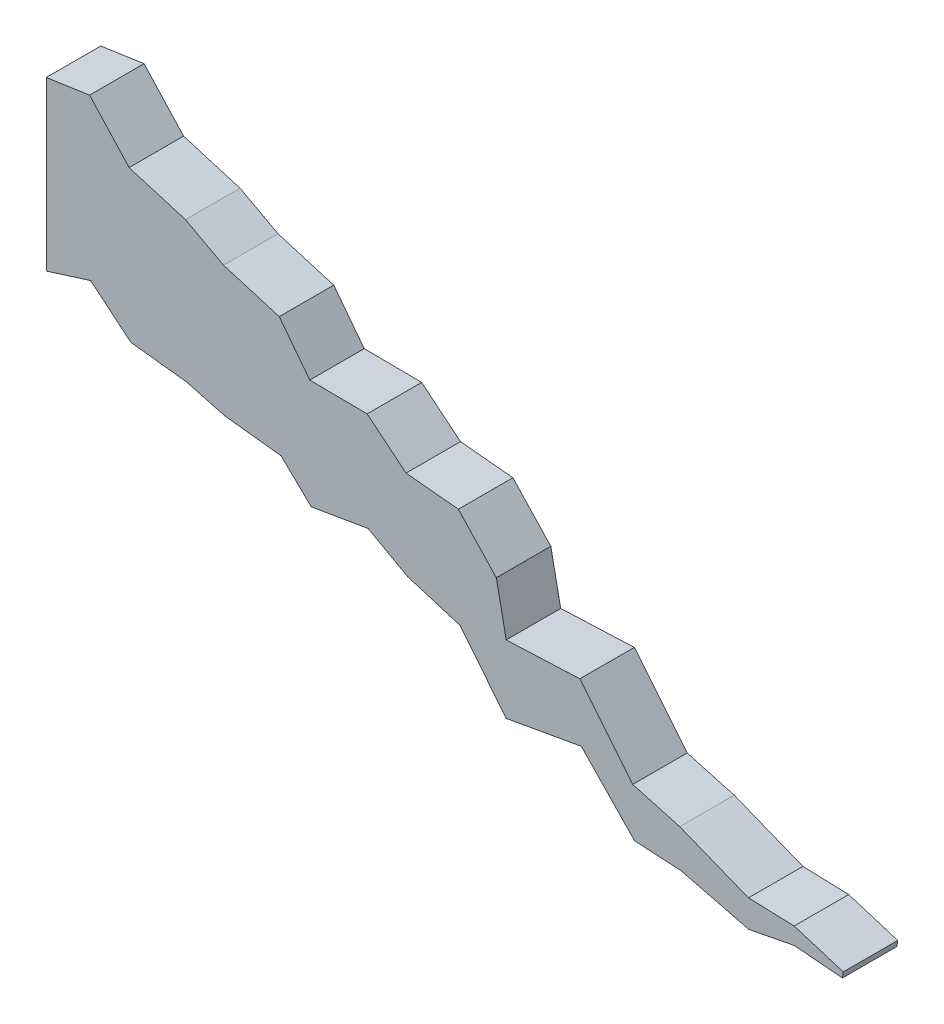
from build123d import *

# Parameters (mm, degrees)
AUFSATZ_LINEAR_AUSTRAGEN1_DEPTH = 3


with BuildPart() as part:
    # Model → Aufsatz-Linear austragen1 (new body)
    with BuildSketch(Plane.XY):
        Polygon((0.100002973, 21.382926037), (2.483723903, 21.732488463), (4.660391968, 19.365018426), (7.766782143, 18.438250331), (9.860166156, 17.310250324), (12.928809347, 16.39474475), (14.609248658, 14.207117874), (17.768038069, 14.175898663), (19.907927605, 12.421887606), (22.791804477, 12.141385336), (24.880255696, 9.916980732), (25.424745963, 7.225032787), (29.47805907, 7.396383747), (32.389877734, 3.816514081), (34.981887273, 3.099074321), (38.762220553, 1.593951582), (41.282467312, 1.51250891), (43.982177547, 0.674101398), (43.936284408, 0.359630474), (41.293914252, 0.58394039), (38.785699445, 0.10235605), (35.028837223, 1.035526349), (32.492086292, 1.179768784), (29.558898953, 4.219564922), (27.881161621, 3.919998058), (26.31288051, 3.639974039), (25.423016437, 3.481084955), (22.884935607, 6.644363115), (19.987208099, 7.531003802), (17.822133234, 8.735563978), (14.691957889, 8.204773563), (13.033468488, 9.803439237), (9.917423285, 10.163852966), (7.824039285, 10.727407966), (4.756385356, 11.082224575), (2.54349926, 12.919739513), (0.100000043, 12.150537333), align=None)
    extrude(amount=AUFSATZ_LINEAR_AUSTRAGEN1_DEPTH)


solid = part.part
